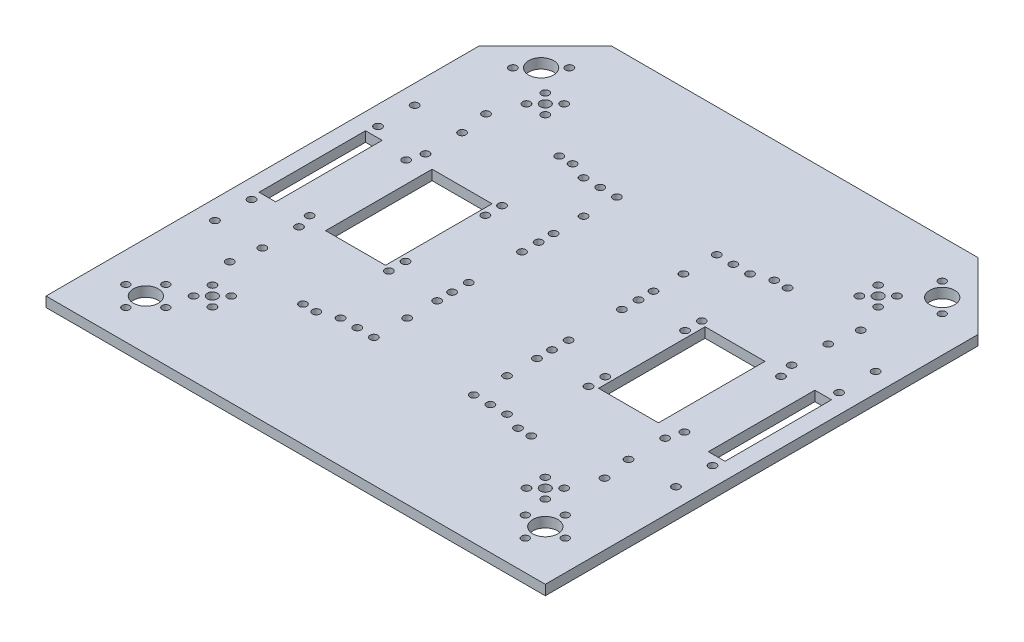
from build123d import *

# Parameters (mm, degrees)
ESQUISSE1_R              = 7.5
ESQUISSE1_R_2            = 2.3
ESQUISSE1_R_3            = 2.2
BOSS_EXTRU_1_DEPTH       = 6
ENL_V_MAT_EXTRU_9_DEPTH  = 10.5
ESQUISSE6_R              = 2.3
ENL_V_MAT_EXTRU_10_DEPTH = 50
ENL_V_MAT_EXTRU_11_DEPTH = 50
ESQUISSE9_R              = 3
ESQUISSE9_R_2            = 2.3
ENL_V_MAT_EXTRU_12_DEPTH = 35
ESQUISSE3_R              = 2.3
ENL_V_MAT_EXTRU_13_DEPTH = 35
ESQUISSE10_R             = 2.3
ENL_V_MAT_EXTRU_14_DEPTH = 10
ESQUISSE11_R             = 2.3
ENL_V_MAT_EXTRU_15_DEPTH = 10


with BuildPart() as part:
    # Esquisse1 → Boss.-Extru.1 (new body)
    with BuildSketch(Plane(origin=(0, 0, 0), x_dir=(1, 0, 0), z_dir=(0, 1, 0))):
        Polygon((-150, 0), (-150, 260), (-110, 300), (110, 300), (150, 260), (150, 0), align=None)
        with Locations(Location((-120, 30, 0), (0, 0, 270))):
            Circle(ESQUISSE1_R, mode=Mode.SUBTRACT)
        with Locations(Location((-120, 267.5, 0), (0, 0, 270))):
            Circle(ESQUISSE1_R, mode=Mode.SUBTRACT)
        with Locations(Location((120, 268.5, 0), (0, 0, 270))):
            Circle(ESQUISSE1_R, mode=Mode.SUBTRACT)
        with Locations(Location((-111.514718626, 275.985281374, 0), (0, 0, 270))):
            Circle(ESQUISSE1_R_2, mode=Mode.SUBTRACT)
        with Locations(Location((-128.485281374, 259.014718626, 0), (0, 0, 270))):
            Circle(ESQUISSE1_R_2, mode=Mode.SUBTRACT)
        with Locations(Location((111.514718626, 276.985281374, 0), (0, 0, 270))):
            Circle(ESQUISSE1_R_3, mode=Mode.SUBTRACT)
        with Locations(Location((128.485281374, 260.014718626, 0), (0, 0, 270))):
            Circle(ESQUISSE1_R_3, mode=Mode.SUBTRACT)
        with Locations(Location((120, 30, 0), (0, 0, 270))):
            Circle(ESQUISSE1_R, mode=Mode.SUBTRACT)
        with Locations(Location((120, 42, 0), (0, 0, 270))):
            Circle(ESQUISSE1_R_3, mode=Mode.SUBTRACT)
        with Locations(Location((-120, 42, 0), (0, 0, 270))):
            Circle(ESQUISSE1_R_3, mode=Mode.SUBTRACT)
        with Locations(Location((-120, 18, 0), (0, 0, 270))):
            Circle(ESQUISSE1_R_3, mode=Mode.SUBTRACT)
        with Locations(Location((-132, 30, 0), (0, 0, 270))):
            Circle(ESQUISSE1_R_3, mode=Mode.SUBTRACT)
        with Locations(Location((-108, 30, 0), (0, 0, 270))):
            Circle(ESQUISSE1_R_3, mode=Mode.SUBTRACT)
        with Locations(Location((108, 30, 0), (0, 0, 270))):
            Circle(ESQUISSE1_R_3, mode=Mode.SUBTRACT)
        with Locations(Location((132, 30, 0), (0, 0, 270))):
            Circle(ESQUISSE1_R_3, mode=Mode.SUBTRACT)
        with Locations(Location((120, 18, 0), (0, 0, 270))):
            Circle(ESQUISSE1_R_3, mode=Mode.SUBTRACT)
    extrude(amount=BOSS_EXTRU_1_DEPTH)

    # Esquisse7 → Enlèv. mat.-Extru.9 (cut)
    with BuildSketch(Plane(origin=(0, 6, 0), x_dir=(1, 0, 0), z_dir=(0, 1, 0))):
        Polygon((-130, 150), (-130, 182), (-140, 182), (-140, 118), (-130, 118), align=None)
    enl_v_mat_extru_9 = extrude(amount=-ENL_V_MAT_EXTRU_9_DEPTH, mode=Mode.SUBTRACT)

    # Esquisse6 → Enlèv. mat.-Extru.10 (cut)
    with BuildSketch(Plane(origin=(0, 6, 0), x_dir=(1, 0, 0), z_dir=(0, 1, 0))):
        with Locations(Location((110, 210, 0), (0, 0, 270))):
            Circle(ESQUISSE6_R)
        with Locations(Location((138.5, 210, 0), (0, 0, 270))):
            Circle(ESQUISSE6_R)
        with Locations(Location((138.5, 188, 0), (0, 0, 270))):
            Circle(ESQUISSE6_R)
        with Locations(Location((110, 188, 0), (0, 0, 270))):
            Circle(ESQUISSE6_R)
        with Locations(Location((-138.5, 90, 0), (0, 0, 270))):
            Circle(ESQUISSE6_R)
        with Locations(Location((-138.5, 112, 0), (0, 0, 270))):
            Circle(ESQUISSE6_R)
        with Locations(Location((-110, 112, 0), (0, 0, 270))):
            Circle(ESQUISSE6_R)
        with Locations(Location((-110, 90, 0), (0, 0, 270))):
            Circle(ESQUISSE6_R)
    enl_v_mat_extru_10 = extrude(amount=-ENL_V_MAT_EXTRU_10_DEPTH, mode=Mode.SUBTRACT)

    # Esquisse4 → Enlèv. mat.-Extru.11 (cut)
    with BuildSketch(Plane(origin=(0, 6, 0), x_dir=(1, 0, 0), z_dir=(0, 1, 0))):
        Polygon((-100, 150), (-100, 182), (-64, 182), (-64, 118), (-100, 118), align=None)
    enl_v_mat_extru_11 = extrude(amount=-ENL_V_MAT_EXTRU_11_DEPTH, mode=Mode.SUBTRACT)

    # Symétrie1: Enlèv. mat.-Extru.9 across plane
    add(enl_v_mat_extru_9.mirror(Plane(origin=(0, 0, 0), x_dir=(0, 0, 1), z_dir=(1, 0, 0))), mode=Mode.SUBTRACT)

    # Symétrie2: Enlèv. mat.-Extru.11 across plane
    add(enl_v_mat_extru_11.mirror(Plane(origin=(0, 0, 0), x_dir=(0, 0, 1), z_dir=(1, 0, 0))), mode=Mode.SUBTRACT)

    # Symétrie3: Enlèv. mat.-Extru.10 across plane
    add(enl_v_mat_extru_10.mirror(Plane(origin=(0, 0, 0), x_dir=(0, 0, 1), z_dir=(1, 0, 0))), mode=Mode.SUBTRACT)

    # Esquisse9 → Enlèv. mat.-Extru.12 (cut)
    with BuildSketch(Plane(origin=(0, 6, 0), x_dir=(1, 0, 0), z_dir=(0, 1, 0))):
        with Locations(Location((-100, 50, 0), (0, 0, 270))):
            Circle(ESQUISSE9_R)
        with Locations(Location((100, 50, 0), (0, 0, 270))):
            Circle(ESQUISSE9_R)
        with Locations(Location((100, 250, 0), (0, 0, 270))):
            Circle(ESQUISSE9_R)
        with Locations(Location((-100, 250, 0), (0, 0, 270))):
            Circle(ESQUISSE9_R)
        with Locations(Location((-105.656854249, 255.656854249, 0), (0, 0, 270))):
            Circle(ESQUISSE9_R_2)
        with Locations(Location((-94.343145751, 244.343145751, 0), (0, 0, 270))):
            Circle(ESQUISSE9_R_2)
        with Locations(Location((94.343145751, 244.343145751, 0), (0, 0, 270))):
            Circle(ESQUISSE9_R_2)
        with Locations(Location((105.656854249, 255.656854249, 0), (0, 0, 270))):
            Circle(ESQUISSE9_R_2)
        with Locations(Location((94.343145751, 55.656854249, 0), (0, 0, 270))):
            Circle(ESQUISSE9_R_2)
        with Locations(Location((105.656854249, 44.343145751, 0), (0, 0, 270))):
            Circle(ESQUISSE9_R_2)
        with Locations(Location((-105.656854249, 44.343145751, 0), (0, 0, 270))):
            Circle(ESQUISSE9_R_2)
        with Locations(Location((-94.343145751, 55.656854249, 0), (0, 0, 270))):
            Circle(ESQUISSE9_R_2)
        with Locations(Location((-105.656854249, 55.656854249, 0), (0, 0, 270))):
            Circle(ESQUISSE9_R_2)
        with Locations(Location((-94.343145751, 44.343145751, 0), (0, 0, 270))):
            Circle(ESQUISSE9_R_2)
        with Locations(Location((105.656854249, 55.656854249, 0), (0, 0, 270))):
            Circle(ESQUISSE9_R_2)
        with Locations(Location((94.343145751, 44.343145751, 0), (0, 0, 270))):
            Circle(ESQUISSE9_R_2)
        with Locations(Location((105.656854249, 244.343145751, 0), (0, 0, 270))):
            Circle(ESQUISSE9_R_2)
        with Locations(Location((94.343145751, 255.656854249, 0), (0, 0, 270))):
            Circle(ESQUISSE9_R_2)
        with Locations(Location((-94.343145751, 255.656854249, 0), (0, 0, 270))):
            Circle(ESQUISSE9_R_2)
        with Locations(Location((-105.656854249, 244.343145751, 0), (0, 0, 270))):
            Circle(ESQUISSE9_R_2)
    extrude(amount=-ENL_V_MAT_EXTRU_12_DEPTH, mode=Mode.SUBTRACT)

    # Esquisse3 → Enlèv. mat.-Extru.13 (cut)
    with BuildSketch(Plane(origin=(0, 6, 0), x_dir=(1, 0, 0), z_dir=(0, 1, 0))):
        with Locations(Location((-60, 174, 0), (0, 0, 270))):
            Circle(ESQUISSE3_R)
        with Locations(Location((-60, 116, 0), (0, 0, 270))):
            Circle(ESQUISSE3_R)
        with Locations(Location((-30, 166, 0), (0, 0, 270))):
            Circle(ESQUISSE3_R)
        with Locations(Location((-30, 124, 0), (0, 0, 270))):
            Circle(ESQUISSE3_R)
        with Locations(Location((60, 184, 0), (0, 0, 270))):
            Circle(ESQUISSE3_R)
        with Locations(Location((30, 176, 0), (0, 0, 270))):
            Circle(ESQUISSE3_R)
        with Locations(Location((30, 134, 0), (0, 0, 270))):
            Circle(ESQUISSE3_R)
        with Locations(Location((60, 126, 0), (0, 0, 270))):
            Circle(ESQUISSE3_R)
    enl_v_mat_extru_13 = extrude(amount=-ENL_V_MAT_EXTRU_13_DEPTH, mode=Mode.SUBTRACT)

    # Symétrie4: Enlèv. mat.-Extru.13 across plane
    add(enl_v_mat_extru_13.mirror(Plane(origin=(0, 0, 0), x_dir=(0, 0, 1), z_dir=(1, 0, 0))), mode=Mode.SUBTRACT)

    # Esquisse10 → Enlèv. mat.-Extru.14 (cut)
    with BuildSketch(Plane(origin=(0, 6, 0), x_dir=(1, 0, 0), z_dir=(0, 1, 0))):
        with Locations(Location((-112.6, 227, 0), (0, 0, 270))):
            Circle(ESQUISSE10_R)
        with Locations(Location((-68.6, 227, 0), (0, 0, 270))):
            Circle(ESQUISSE10_R)
        with Locations(Location((-60.6, 227, 0), (0, 0, 270))):
            Circle(ESQUISSE10_R)
        with Locations(Location((112.6, 73, 0), (0, 0, 270))):
            Circle(ESQUISSE10_R)
        with Locations(Location((68.6, 73, 0), (0, 0, 270))):
            Circle(ESQUISSE10_R)
        with Locations(Location((60.6, 73, 0), (0, 0, 270))):
            Circle(ESQUISSE10_R)
        with Locations(Location((-112.6, 179, 0), (0, 0, 270))):
            Circle(ESQUISSE10_R)
        with Locations(Location((112.6, 121, 0), (0, 0, 270))):
            Circle(ESQUISSE10_R)
    enl_v_mat_extru_14 = extrude(amount=-ENL_V_MAT_EXTRU_14_DEPTH, mode=Mode.SUBTRACT)

    # Symétrie5: Enlèv. mat.-Extru.14 across plane
    add(enl_v_mat_extru_14.mirror(Plane(origin=(0, 0, 0), x_dir=(0, 0, 1), z_dir=(1, 0, 0))), mode=Mode.SUBTRACT)

    # Esquisse11 → Enlèv. mat.-Extru.15 (cut)
    with BuildSketch(Plane(origin=(0, 6, 0), x_dir=(1, 0, 0), z_dir=(0, 1, 0))):
        with Locations(Location((30, 97, 0), (0, 0, 270))):
            Circle(ESQUISSE11_R)
        with Locations(Location((30, 77, 0), (0, 0, 270))):
            Circle(ESQUISSE11_R)
        with Locations(Location((-30, 203, 0), (0, 0, 270))):
            Circle(ESQUISSE11_R)
        with Locations(Location((-30, 223, 0), (0, 0, 270))):
            Circle(ESQUISSE11_R)
        with Locations(Location((-30, 185, 0), (0, 0, 270))):
            Circle(ESQUISSE11_R)
        with Locations(Location((30, 115, 0), (0, 0, 270))):
            Circle(ESQUISSE11_R)
        with Locations(Location((-40, 223, 0), (0, 0, 270))):
            Circle(ESQUISSE11_R)
        with Locations(Location((-50, 223, 0), (0, 0, 270))):
            Circle(ESQUISSE11_R)
        with Locations(Location((40, 77, 0), (0, 0, 270))):
            Circle(ESQUISSE11_R)
        with Locations(Location((50, 77, 0), (0, 0, 270))):
            Circle(ESQUISSE11_R)
    enl_v_mat_extru_15 = extrude(amount=-ENL_V_MAT_EXTRU_15_DEPTH, mode=Mode.SUBTRACT)

    # Symétrie6: Enlèv. mat.-Extru.15 across plane
    add(enl_v_mat_extru_15.mirror(Plane(origin=(0, 0, 0), x_dir=(0, 0, 1), z_dir=(1, 0, 0))), mode=Mode.SUBTRACT)


solid = part.part
